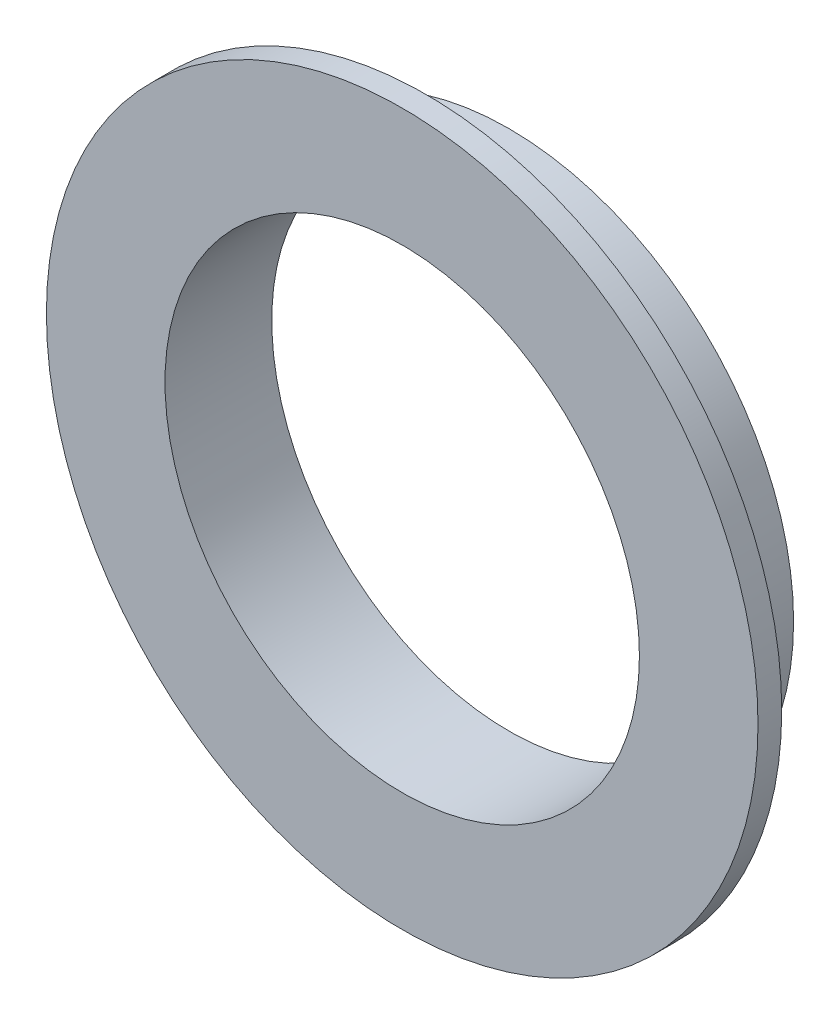
from build123d import *

# Parameters (mm, degrees)
SKETCH1_R           = 12
SKETCH1_R_2         = 10
BOSS_EXTRUDE1_DEPTH = 4.5
SKETCH2_R           = 15
SKETCH2_R_2         = 11
BOSS_EXTRUDE2_DEPTH = 1
SCALE1_SCALE        = 1.013


with BuildPart() as part:
    # Sketch1 → Boss-Extrude1 (new body)
    with BuildSketch(Plane.XY):
        Circle(SKETCH1_R)
        Circle(SKETCH1_R_2, mode=Mode.SUBTRACT)
    extrude(amount=BOSS_EXTRUDE1_DEPTH)

    # Sketch2 → Boss-Extrude2 (add)
    with BuildSketch(Plane.XY.offset(4.5)):
        Circle(SKETCH2_R)
        Circle(SKETCH2_R_2, mode=Mode.SUBTRACT)
    extrude(amount=-BOSS_EXTRUDE2_DEPTH)


with BuildPart() as part_1:
    # Scale1: scaled about (0, 0, 2.758064516)
    add(part.part.scale(SCALE1_SCALE).moved(Location((0, 0, -0.035854839))))


solid = part_1.part
